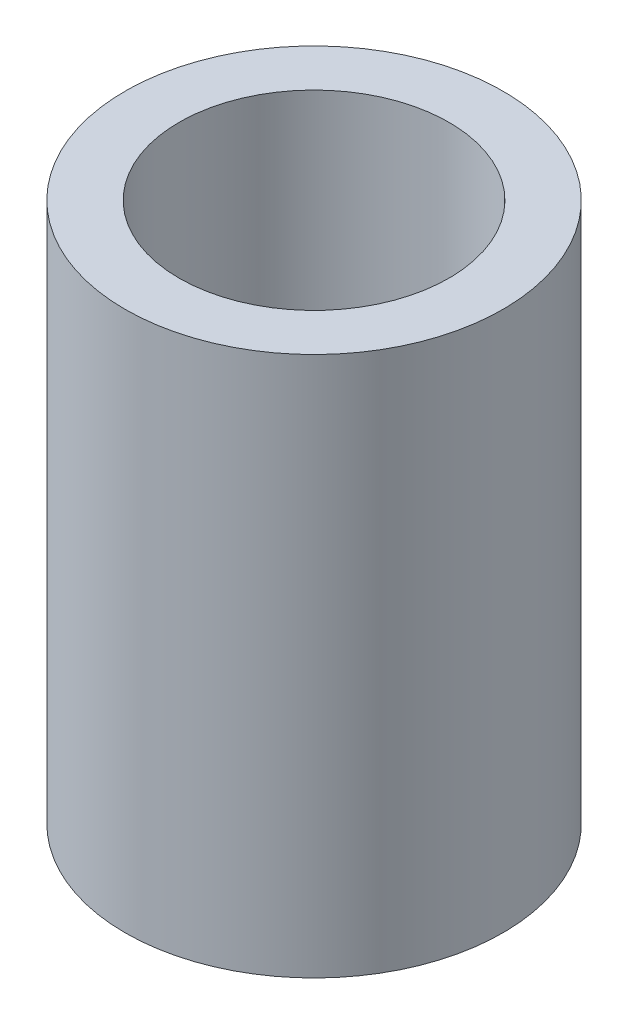
from build123d import *

# Parameters (mm, degrees)
SKETCH1_R           = 10.5
SKETCH1_R_2         = 7.5
BOSS_EXTRUDE1_DEPTH = 15


with BuildPart() as part:
    # Sketch1 → Boss-Extrude1 (new, symmetric)
    with BuildSketch(Plane(origin=(0, 0, 0), x_dir=(1, 0, 0), z_dir=(0, 1, 0))):
        Circle(SKETCH1_R)
        Circle(SKETCH1_R_2, mode=Mode.SUBTRACT)
    extrude(amount=BOSS_EXTRUDE1_DEPTH, both=True)


solid = part.part
